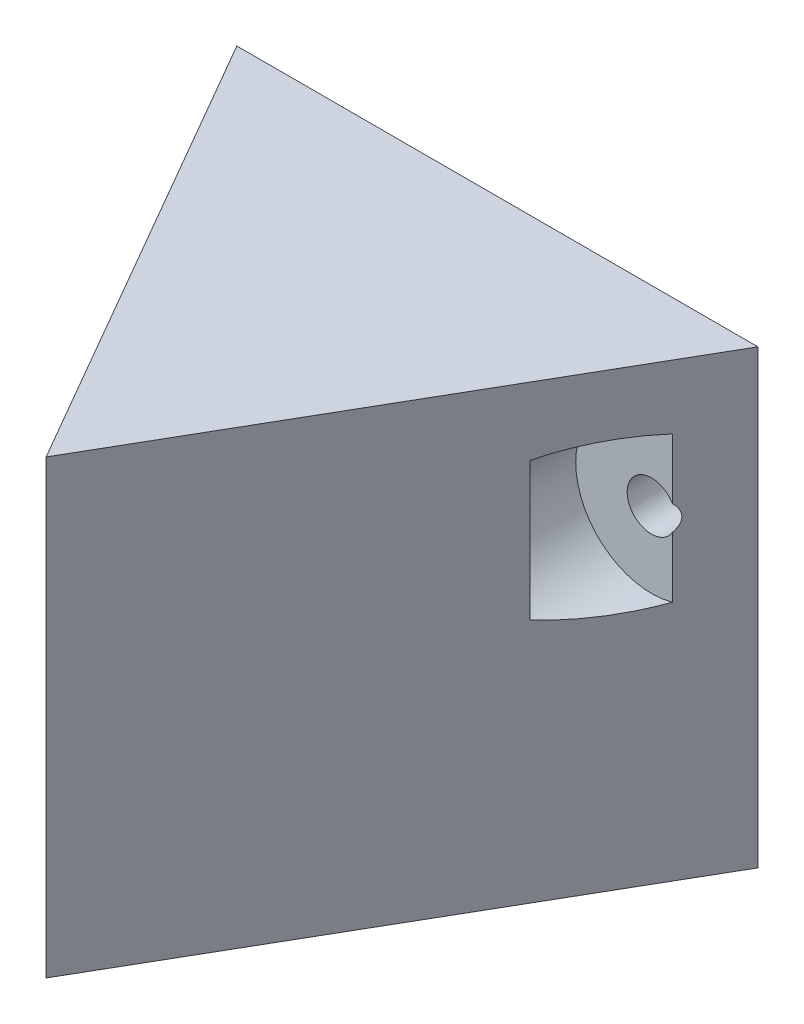
from build123d import *

# Parameters (mm, degrees)
SALIENTE_EXTRUIR1_DEPTH = 25
CROQUIS6_R              = 2.7
CORTAR_EXTRUIR1_DEPTH   = 15
CROQUIS7_R              = 8.4
CORTAR_EXTRUIR2_DEPTH   = 10


with BuildPart() as part:
    # Croquis1 → Saliente-Extruir1 (new, symmetric)
    with BuildSketch(Plane(origin=(0, 0, 0), x_dir=(1, 0, 0), z_dir=(0, 1, 0))):
        Polygon((-28.867513459, 0), (28.867513459, 0), (0, -50), align=None)
    extrude(amount=SALIENTE_EXTRUIR1_DEPTH, both=True)

    # Croquis6 → Cortar-Extruir1 (cut, symmetric)
    with BuildSketch(Plane.XY):
        with Locations((-23.070667369, 0)):
            Circle(CROQUIS6_R)
        with Locations(Location((23.082974371, 9.835520027, 0), (0, 0, 180))):
            Circle(CROQUIS6_R)
    extrude(amount=CORTAR_EXTRUIR1_DEPTH, both=True, mode=Mode.SUBTRACT)

    # Croquis7 → Cortar-Extruir2 (cut)
    with BuildSketch(Plane(origin=(0, 0, 6), x_dir=(-1, 0, 0), z_dir=(0, 0, -1))):
        with Locations((-23.082974371, 9.835520027)):
            Circle(CROQUIS7_R)
        with Locations((23.070667369, 0)):
            Circle(CROQUIS7_R)
    extrude(amount=-CORTAR_EXTRUIR2_DEPTH, mode=Mode.SUBTRACT)


solid = part.part
